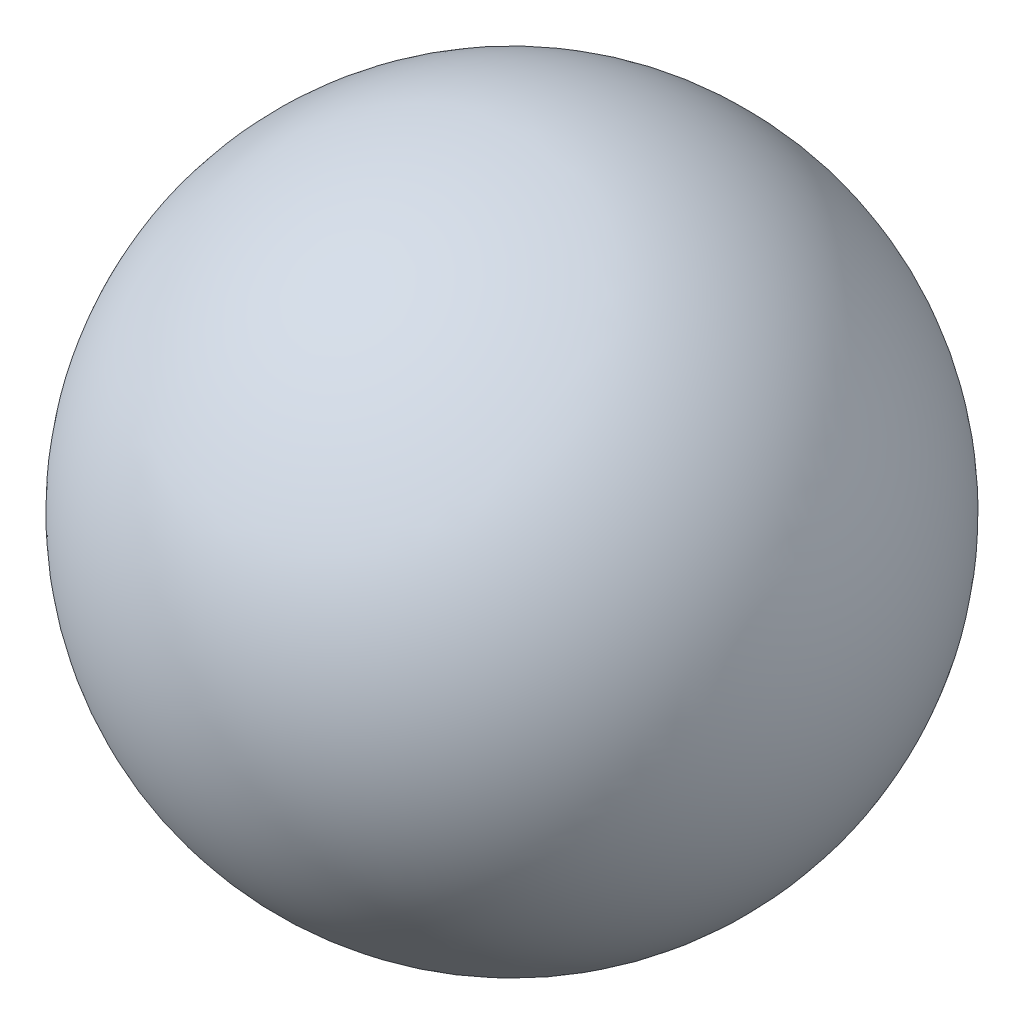
from build123d import *


with BuildPart() as part:
    # Sketch1 → Revolve1 (revolve)
    with BuildSketch(Plane.XY):
        with BuildLine():
            Line((-6.35, 0), (6.35, 0))
            ThreePointArc((6.35, 0), (0, 6.35), (-6.35, 0))
        make_face()
    revolve(axis=Axis((-6.35, 0, 0), (1, 0, 0)))


solid = part.part
